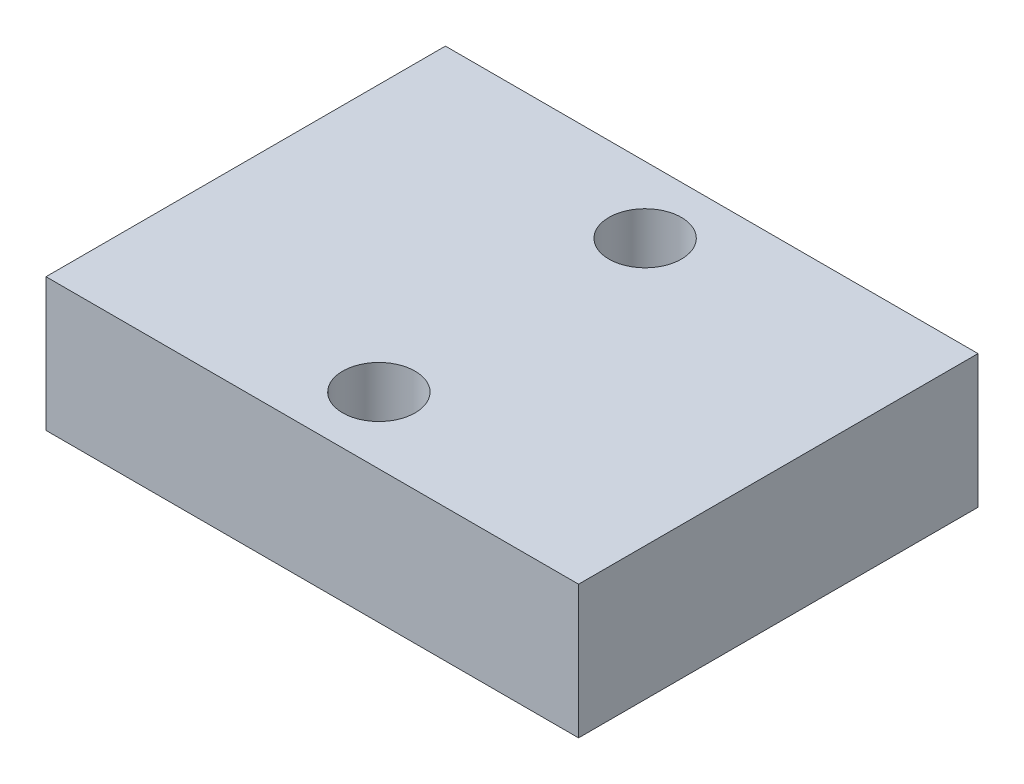
from build123d import *

# Parameters (mm, degrees)
SKETCH1_W             = 25.4
SKETCH1_H             = 19.05
BOSS_EXTRUDE1_DEPTH   = 3.175
F_8_32_TAPPED_HOLE1_D = 3.4544


with BuildPart() as part:
    # Sketch1 → Boss-Extrude1 (new, symmetric)
    with BuildSketch(Plane(origin=(0, 0, 0), x_dir=(1, 0, 0), z_dir=(0, 1, 0))):
        Rectangle(SKETCH1_W, SKETCH1_H)
    extrude(amount=BOSS_EXTRUDE1_DEPTH, both=True)

    # #8-32 Tapped Hole1 (through all)
    with Locations(Plane(origin=(0, 3.175, 0), x_dir=(1, 0, 0), z_dir=(0, 1, 0))):
        with Locations((0, 6.35), (0, -6.35)):
            Hole(F_8_32_TAPPED_HOLE1_D / 2)


solid = part.part
